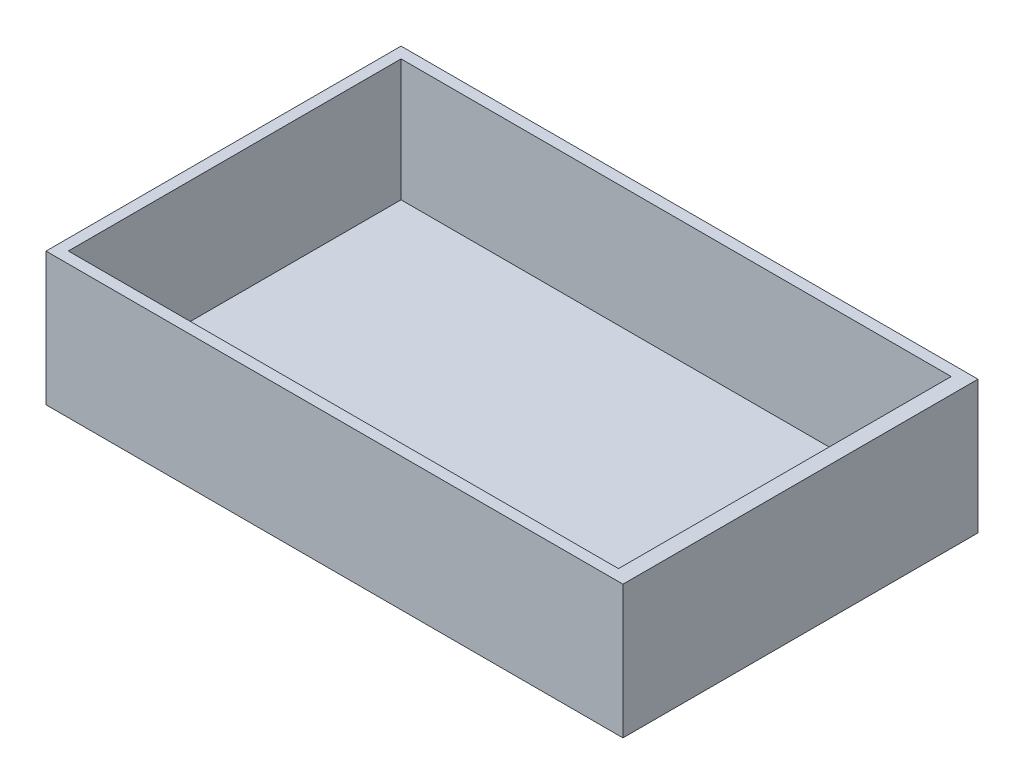
from build123d import *

# Parameters (mm, degrees)
SKIZZE1_W                       = 520
SKIZZE1_H                       = 320
AUFSATZ_LINEAR_AUSTRAGEN1_DEPTH = 10
SKIZZE2_W                       = 520
SKIZZE2_H                       = 320
SKIZZE2_W_2                     = 495.843348952
SKIZZE2_H_2                     = 299.868191812
AUFSATZ_LINEAR_AUSTRAGEN2_DEPTH = 110


with BuildPart() as part:
    # Skizze1 → Aufsatz-Linear austragen1 (new body)
    with BuildSketch(Plane(origin=(0, 0, 0), x_dir=(1, 0, 0), z_dir=(0, 1, 0))):
        with Locations((260, 160)):
            Rectangle(SKIZZE1_W, SKIZZE1_H)
    extrude(amount=AUFSATZ_LINEAR_AUSTRAGEN1_DEPTH)

    # Skizze2 → Aufsatz-Linear austragen2 (add)
    with BuildSketch(Plane(origin=(0, 10, 0), x_dir=(1, 0, 0), z_dir=(0, 1, 0))):
        with Locations((260, 160)):
            Rectangle(SKIZZE2_W, SKIZZE2_H)
        with Locations((257.921674476, 160.065904094)):
            Rectangle(SKIZZE2_W_2, SKIZZE2_H_2, mode=Mode.SUBTRACT)
    extrude(amount=AUFSATZ_LINEAR_AUSTRAGEN2_DEPTH)


solid = part.part
